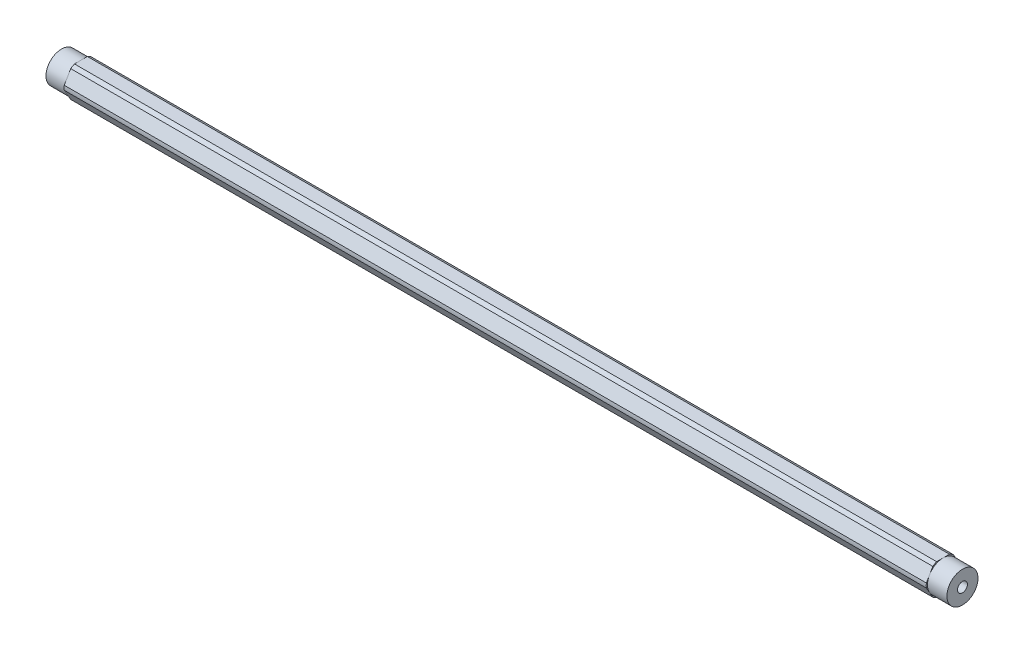
from build123d import *

# Parameters (mm, degrees)
SKETCH1_R               = 2.0193
BOSS_EXTRUDE1_DEPTH     = 184.15
SKETCH2_R               = 8.89
SKETCH2_R_2             = 6.35
CUT_EXTRUDE_THIN1_DEPTH = 7.9375


with BuildPart() as part:
    # Sketch1 → Boss-Extrude1 (new, symmetric)
    with BuildSketch(Plane(origin=(0, 0, 0), x_dir=(0, 0, -1), z_dir=(1, 0, 0))):
        with BuildLine():
            ThreePointArc((4.181770846, 5.456960429), (3.437499983, 5.953924622), (2.634980936, 6.35))
            Line((2.634980936, 6.35), (-2.634980936, 6.35))
            ThreePointArc((-2.634980936, 6.35), (-3.437499983, 5.953924622), (-4.181770846, 5.456960429))
            Line((-4.181770846, 5.456960429), (-6.816751782, 0.893039571))
            ThreePointArc((-6.816751782, 0.893039571), (-6.874999966, 0), (-6.816751782, -0.893039571))
            Line((-6.816751782, -0.893039571), (-4.181770846, -5.456960429))
            ThreePointArc((-4.181770846, -5.456960429), (-3.437499983, -5.953924622), (-2.634980936, -6.35))
            Line((-2.634980936, -6.35), (2.634980936, -6.35))
            ThreePointArc((2.634980936, -6.35), (3.437499983, -5.953924622), (4.181770846, -5.456960429))
            Line((4.181770846, -5.456960429), (6.816751782, -0.893039571))
            ThreePointArc((6.816751782, -0.893039571), (6.860422465, -0.447468582), (6.874999966, 0))
            ThreePointArc((6.874999966, 0), (6.860422465, 0.447468582), (6.816751782, 0.893039571))
            Line((6.816751782, 0.893039571), (4.181770846, 5.456960429))
        make_face()
        Circle(SKETCH1_R, mode=Mode.SUBTRACT)
    extrude(amount=BOSS_EXTRUDE1_DEPTH, both=True)

    # Sketch2 → Cut-Extrude-Thin1 (cut)
    with BuildSketch(Plane(origin=(184.15, 0, 0), x_dir=(0, 0, -1), z_dir=(1, 0, 0))):
        Circle(SKETCH2_R)
        Circle(SKETCH2_R_2, mode=Mode.SUBTRACT)
    cut_extrude_thin1 = extrude(amount=-CUT_EXTRUDE_THIN1_DEPTH, mode=Mode.SUBTRACT)

    # Mirror1: Cut-Extrude-Thin1 across plane
    add(cut_extrude_thin1.mirror(Plane(origin=(0, 0, 0), x_dir=(0, 0, 1), z_dir=(1, 0, 0))), mode=Mode.SUBTRACT)


solid = part.part
